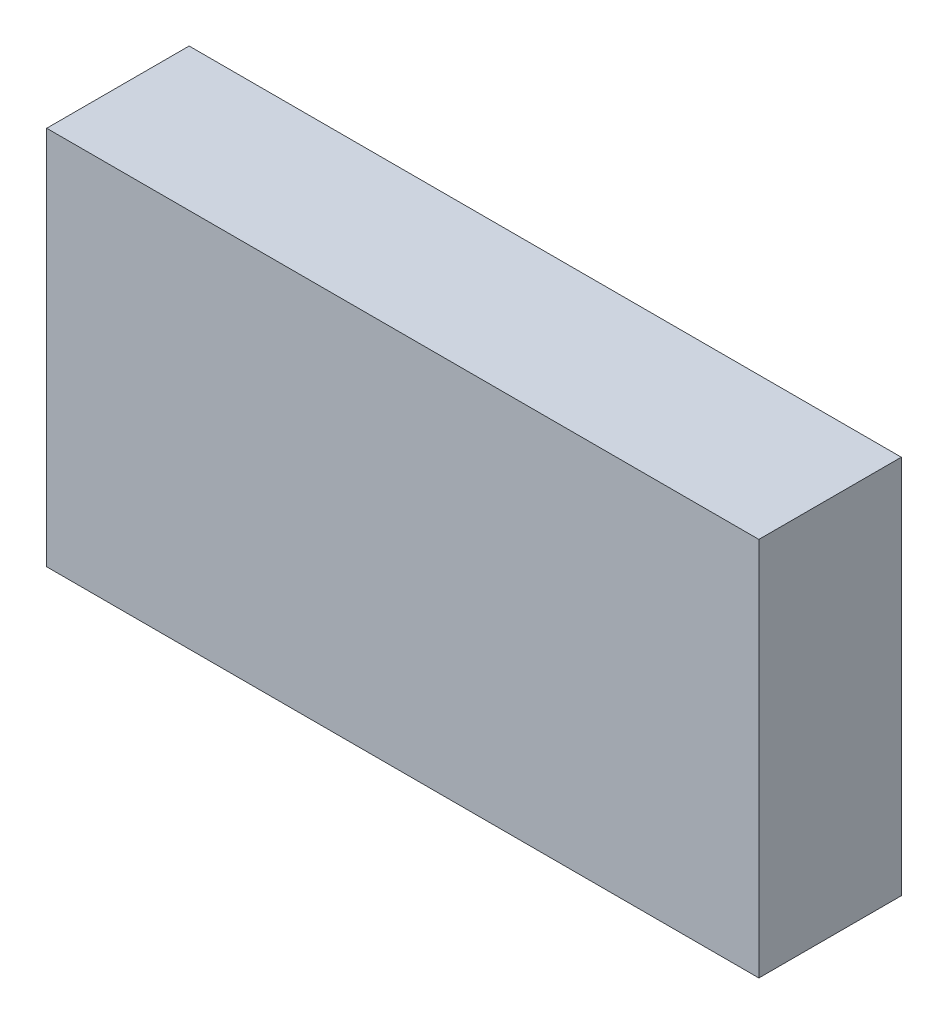
from build123d import *

# Parameters (mm, degrees)
SKETCH1_W                          = 15
SKETCH1_H                          = 8
CEK_DONMUS_MIKNATIS_15X8X3_1_DEPTH = 3


with BuildPart() as part:
    # Sketch1 → CEK_donmus_miknatis_15x8x3_1 (new body)
    with BuildSketch(Plane.XY):
        with Locations((603.5, 78)):
            Rectangle(SKETCH1_W, SKETCH1_H)
    extrude(amount=-CEK_DONMUS_MIKNATIS_15X8X3_1_DEPTH)


solid = part.part
